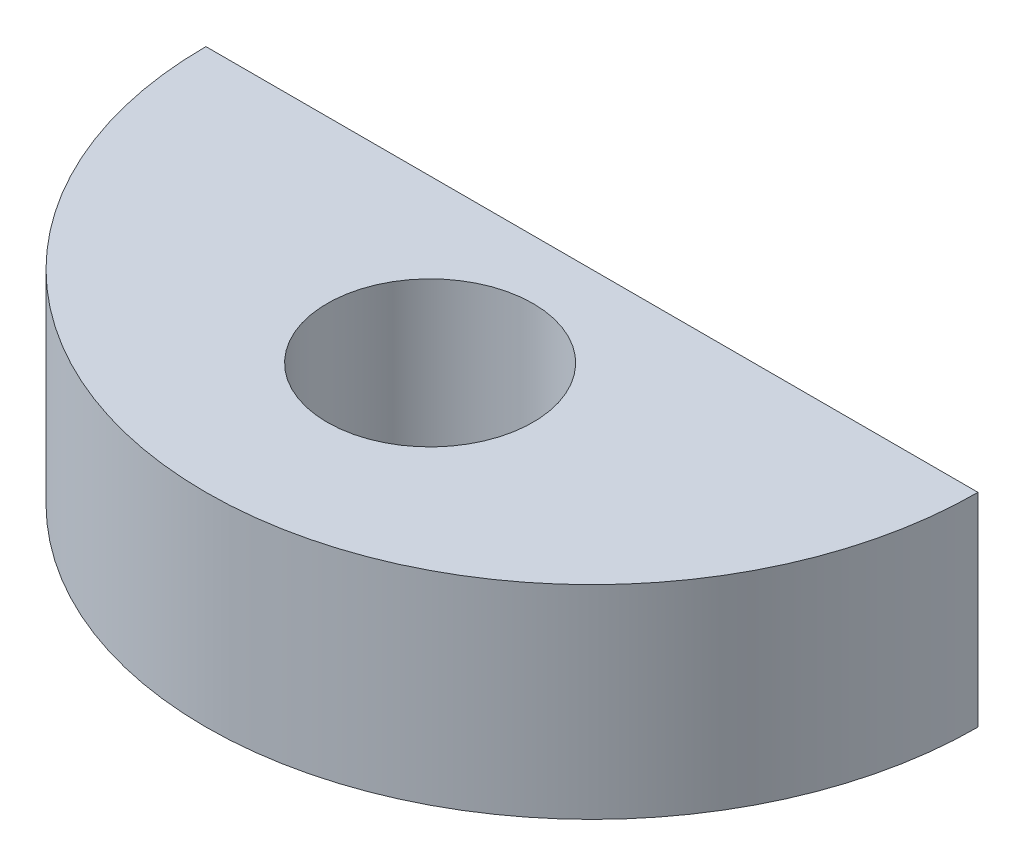
from build123d import *

# Parameters (mm, degrees)
SKETCH3_R           = 10.16
BOSS_EXTRUDE1_DEPTH = 20.066


with BuildPart() as part:
    # Sketch3 → Boss-Extrude1 (new body)
    with BuildSketch(Plane(origin=(0, 0, 0), x_dir=(1, 0, 0), z_dir=(0, 1, 0))):
        with BuildLine():
            Line((-31.093430006, 25.697049592), (45.106569994, 25.697049592))
            ThreePointArc((45.106569994, 25.697049592), (7.006569994, -12.402950408), (-31.093430006, 25.697049592))
        make_face()
        with Locations(Location((7.006569994, 9.724803134, 0), (0, 0, 270))):
            Circle(SKETCH3_R, mode=Mode.SUBTRACT)
    extrude(amount=BOSS_EXTRUDE1_DEPTH)


solid = part.part
